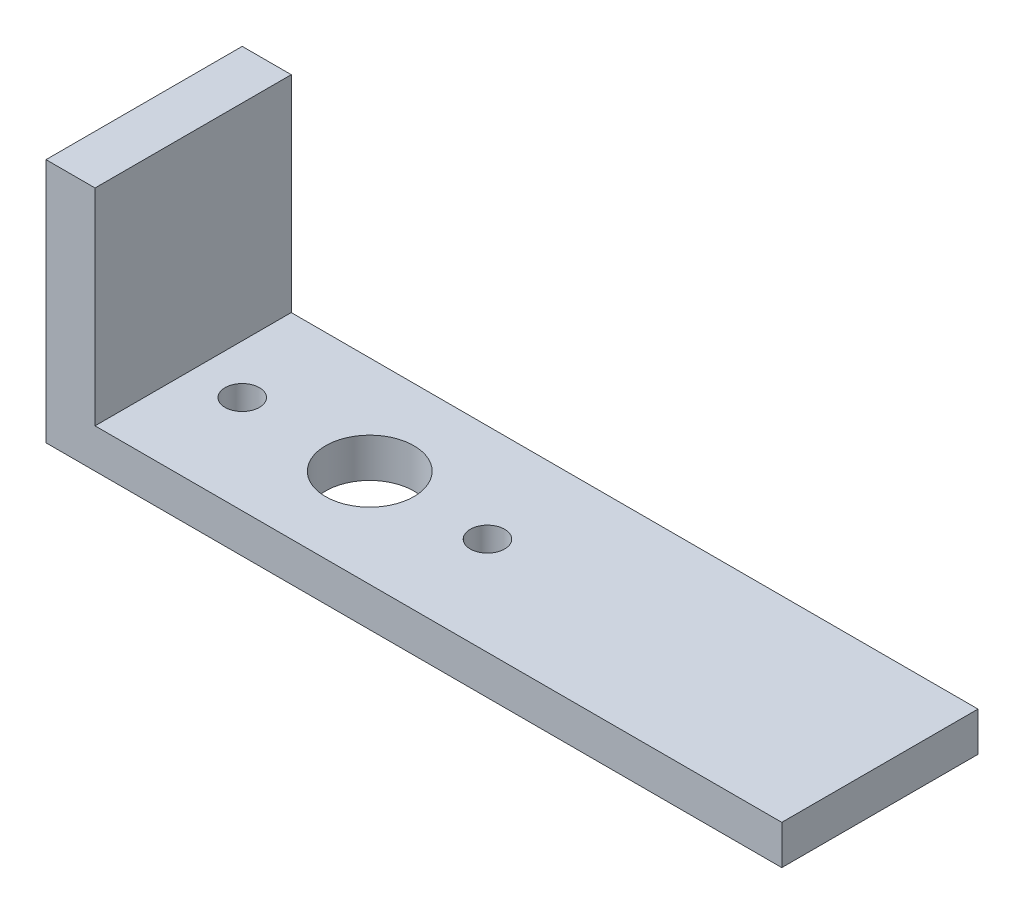
from build123d import *

# Parameters (mm, degrees)
SKETCH_1_W      = 70
SKETCH_1_H      = 20
SKETCH_1_R      = 1.75
SKETCH_1_R_2    = 4.5
EXTRUDE_1_DEPTH = 4
SKETCH_1_3_W    = 5
SKETCH_1_3_H    = 20
EXTRUDE_2_DEPTH = 25


with BuildPart() as part:
    # 草图1 → 凸台-拉伸1 (new body)
    with BuildSketch(Plane(origin=(0, 0, 0), x_dir=(1, 0, 0), z_dir=(0, 1, 0))):
        with Locations((40, 10)):
            Rectangle(SKETCH_1_W, SKETCH_1_H)
        with Locations((10, 10)):
            Circle(SKETCH_1_R, mode=Mode.SUBTRACT)
        with Locations((23, 10)):
            Circle(SKETCH_1_R_2, mode=Mode.SUBTRACT)
        with Locations((35, 10)):
            Circle(SKETCH_1_R, mode=Mode.SUBTRACT)
    extrude(amount=EXTRUDE_1_DEPTH)

    # 草图1<3> → 凸台-拉伸2 (add)
    with BuildSketch(Plane(origin=(0, 0, 0), x_dir=(1, 0, 0), z_dir=(0, 1, 0))):
        with Locations((2.5, 10)):
            Rectangle(SKETCH_1_3_W, SKETCH_1_3_H)
    extrude(amount=EXTRUDE_2_DEPTH)


solid = part.part
